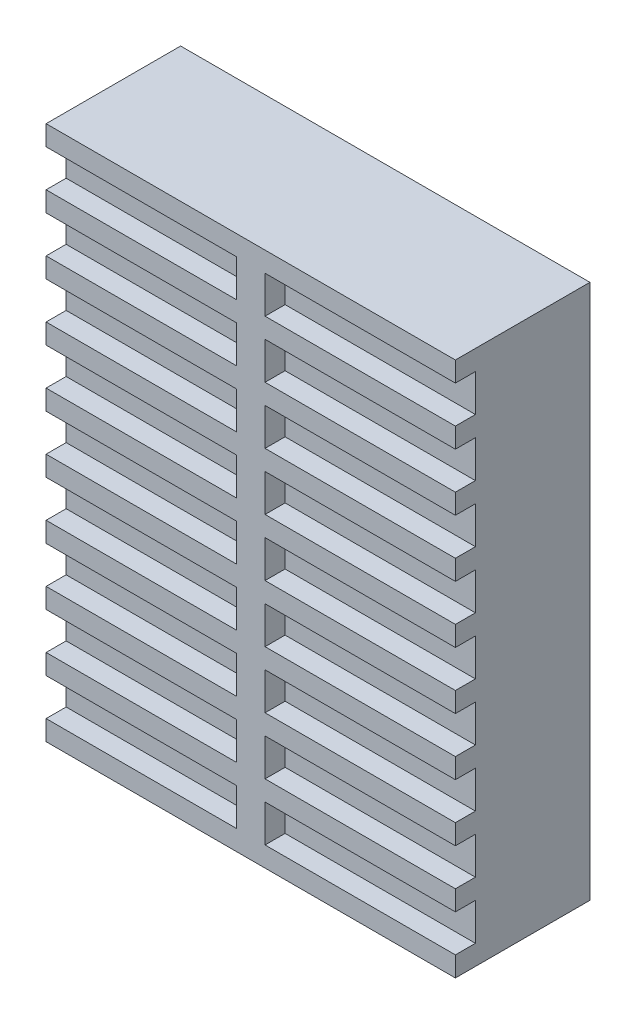
from build123d import *

# Parameters (mm, degrees)
SKETCH_1_W      = 14.3
SKETCH_1_H      = 18.7
EXTRUDE_1_DEPTH = 4
SKETCH_2_W      = 0.7
SKETCH_2_H      = 0.7
EXTRUDE_2_DEPTH = 14.3
SKETCH_3_W      = 1
SKETCH_3_H      = 18.7
EXTRUDE_4_DEPTH = 0.7


with BuildPart() as part:
    # 草图1 → 凸台-拉伸1 (new body)
    with BuildSketch(Plane.XY):
        with Locations((7.15, -9.35)):
            Rectangle(SKETCH_1_W, SKETCH_1_H)
    extrude(amount=EXTRUDE_1_DEPTH)

    # 草图2 → 凸台-拉伸2 (add)
    with BuildSketch(Plane(origin=(14.3, 0, 0), x_dir=(0, 0, -1), z_dir=(1, 0, 0))):
        with Locations((-4.35, -2.35)):
            Rectangle(SKETCH_2_W, SKETCH_2_H)
        with Locations((-4.35, -0.35)):
            Rectangle(SKETCH_2_W, SKETCH_2_H)
        with Locations((-4.35, -4.35)):
            Rectangle(SKETCH_2_W, SKETCH_2_H)
        with Locations((-4.35, -6.35)):
            Rectangle(SKETCH_2_W, SKETCH_2_H)
        with Locations((-4.35, -8.35)):
            Rectangle(SKETCH_2_W, SKETCH_2_H)
        with Locations((-4.35, -10.35)):
            Rectangle(SKETCH_2_W, SKETCH_2_H)
        with Locations((-4.35, -12.35)):
            Rectangle(SKETCH_2_W, SKETCH_2_H)
        with Locations((-4.35, -14.35)):
            Rectangle(SKETCH_2_W, SKETCH_2_H)
        with Locations((-4.35, -16.35)):
            Rectangle(SKETCH_2_W, SKETCH_2_H)
        with Locations((-4.35, -18.35)):
            Rectangle(SKETCH_2_W, SKETCH_2_H)
    extrude(amount=-EXTRUDE_2_DEPTH)

    # 草图3 → 凸台-拉伸4 (add)
    with BuildSketch(Plane.XY.offset(4)):
        with Locations((7.15, -9.35)):
            Rectangle(SKETCH_3_W, SKETCH_3_H)
    extrude(amount=EXTRUDE_4_DEPTH)


solid = part.part
